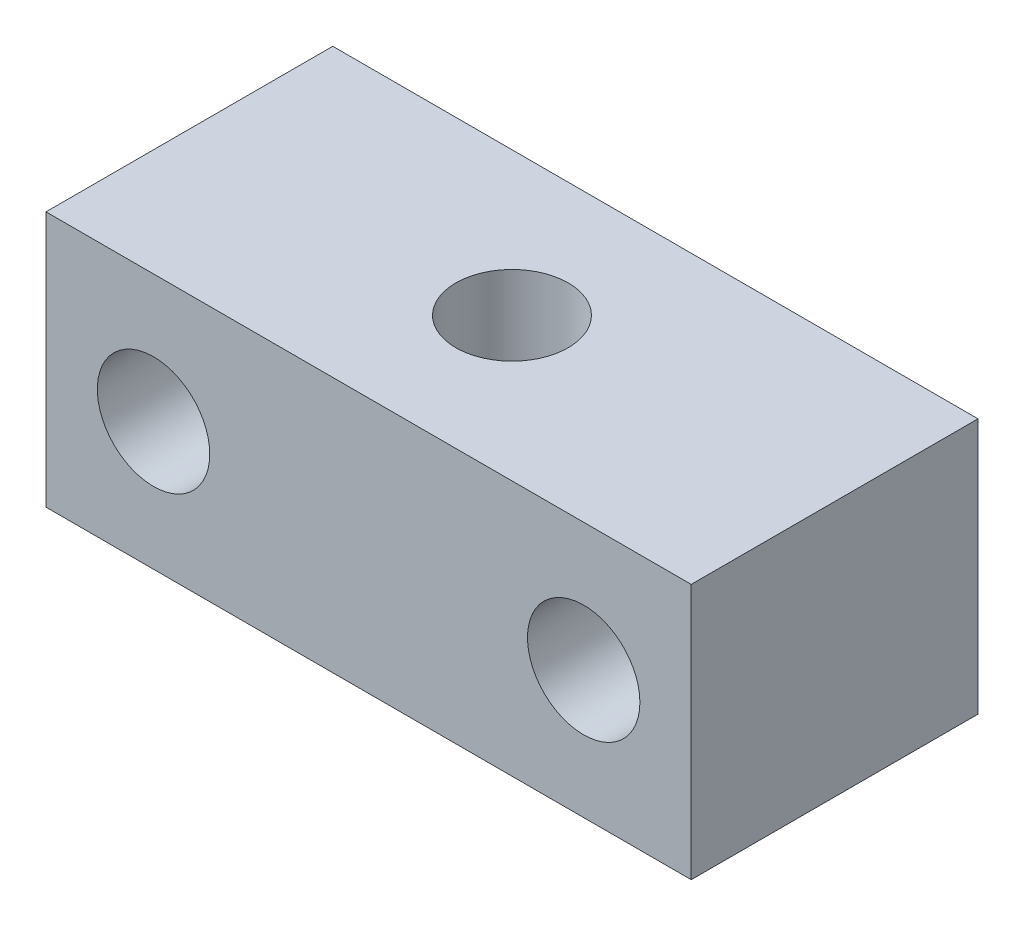
from build123d import *

# Parameters (mm, degrees)
SKETCH1_R           = 2.4892
BOSS_EXTRUDE1_DEPTH = 6.35
SKETCH3_R           = 2.4892
CUT_EXTRUDE1_DEPTH  = 20.307713557


with BuildPart() as part:
    # Sketch1 → Boss-Extrude1 (new, symmetric)
    with BuildSketch(Plane.XY):
        Polygon((-9.525, -5.6642), (9.525, -5.6642), (14.2875, -5.6642), (14.2875, 5.6642), (9.525, 5.6642), (-9.525, 5.6642), (-14.2875, 5.6642), (-14.2875, -5.6642), align=None)
        with Locations((-9.525, 0)):
            Circle(SKETCH1_R, mode=Mode.SUBTRACT)
        with Locations((9.525, 0)):
            Circle(SKETCH1_R, mode=Mode.SUBTRACT)
    extrude(amount=BOSS_EXTRUDE1_DEPTH, both=True)

    # Sketch3 → Cut-Extrude1 (cut, through all)
    with BuildSketch(Plane(origin=(0, 5.6642, 0), x_dir=(1, 0, 0), z_dir=(0, 1, 0))):
        with Locations(Location((0, 0, 0), (0, 0, 180))):
            Circle(SKETCH3_R)
    extrude(amount=-CUT_EXTRUDE1_DEPTH, mode=Mode.SUBTRACT)


solid = part.part
